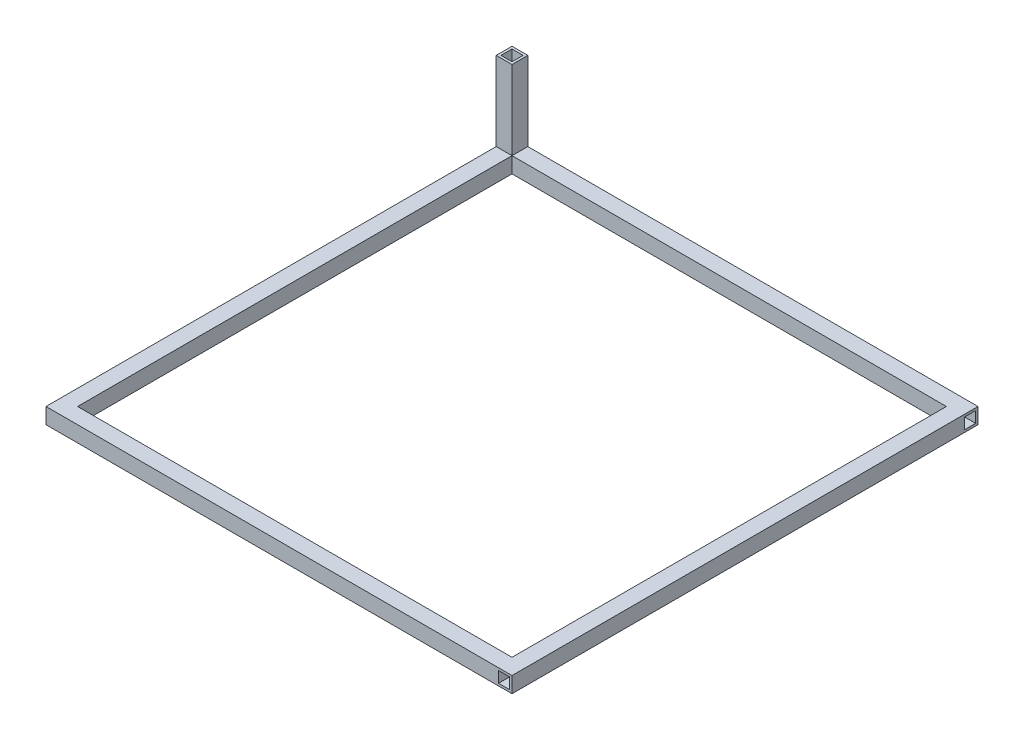
from build123d import *

# Parameters (mm, degrees)
SKETCH_1_W      = 20
SKETCH_1_H      = 20
SKETCH_1_W_2    = 14
SKETCH_1_H_2    = 14
EXTRUDE_1_DEPTH = 570
SKETCH_2_W      = 20
SKETCH_2_H      = 20
SKETCH_2_W_2    = 14
SKETCH_2_H_2    = 14
EXTRUDE_2_DEPTH = 100
SKETCH_5_W      = 20
SKETCH_5_H      = 20
SKETCH_5_W_2    = 14
SKETCH_5_H_2    = 14
EXTRUDE_3_DEPTH = 570
SKETCH_6_W      = 20
SKETCH_6_H      = 20
SKETCH_6_W_2    = 14
SKETCH_6_H_2    = 14
EXTRUDE_4_DEPTH = 570
SKETCH_7_W      = 20
SKETCH_7_H      = 20
SKETCH_7_W_2    = 14
SKETCH_7_H_2    = 14
EXTRUDE_5_DEPTH = 570


with BuildPart() as part:
    # 草图1 → 凸台-拉伸1 (new body)
    with BuildSketch(Plane.XY):
        with Locations((-59.504950495, 20.995577113)):
            Rectangle(SKETCH_1_W, SKETCH_1_H)
        with Locations((-59.504950495, 20.995577113)):
            Rectangle(SKETCH_1_W_2, SKETCH_1_H_2, mode=Mode.SUBTRACT)
    extrude(amount=EXTRUDE_1_DEPTH)

    # 草图2 → 凸台-拉伸2 (add)
    with BuildSketch(Plane(origin=(0, 30.995577113, 0), x_dir=(1, 0, 0), z_dir=(0, 1, 0))):
        with Locations((-59.504950495, -10)):
            Rectangle(SKETCH_2_W, SKETCH_2_H)
        with Locations((-59.504950495, -10)):
            Rectangle(SKETCH_2_W_2, SKETCH_2_H_2, mode=Mode.SUBTRACT)
    extrude(amount=EXTRUDE_2_DEPTH)

    # 草图5 → 凸台-拉伸3 (add)
    with BuildSketch(Plane(origin=(-49.504950495, 0, 0), x_dir=(0, 0, -1), z_dir=(1, 0, 0))):
        with Locations((-10, 20.995577113)):
            Rectangle(SKETCH_5_W, SKETCH_5_H)
        with Locations((-10, 20.995577113)):
            Rectangle(SKETCH_5_W_2, SKETCH_5_H_2, mode=Mode.SUBTRACT)
    extrude(amount=EXTRUDE_3_DEPTH)

    # 草图6 → 凸台-拉伸4 (add)
    with BuildSketch(Plane.XY.offset(20)):
        with Locations((510.495049505, 20.995577113)):
            Rectangle(SKETCH_6_W, SKETCH_6_H)
        with Locations((510.495049505, 20.995577113)):
            Rectangle(SKETCH_6_W_2, SKETCH_6_H_2, mode=Mode.SUBTRACT)
    extrude(amount=EXTRUDE_4_DEPTH)

    # 草图7 → 凸台-拉伸5 (add)
    with BuildSketch(Plane.ZY.offset(-500.495049505)):
        with Locations((580, 20.995577113)):
            Rectangle(SKETCH_7_W, SKETCH_7_H)
        with Locations((580, 20.995577113)):
            Rectangle(SKETCH_7_W_2, SKETCH_7_H_2, mode=Mode.SUBTRACT)
    extrude(amount=EXTRUDE_5_DEPTH)


solid = part.part
